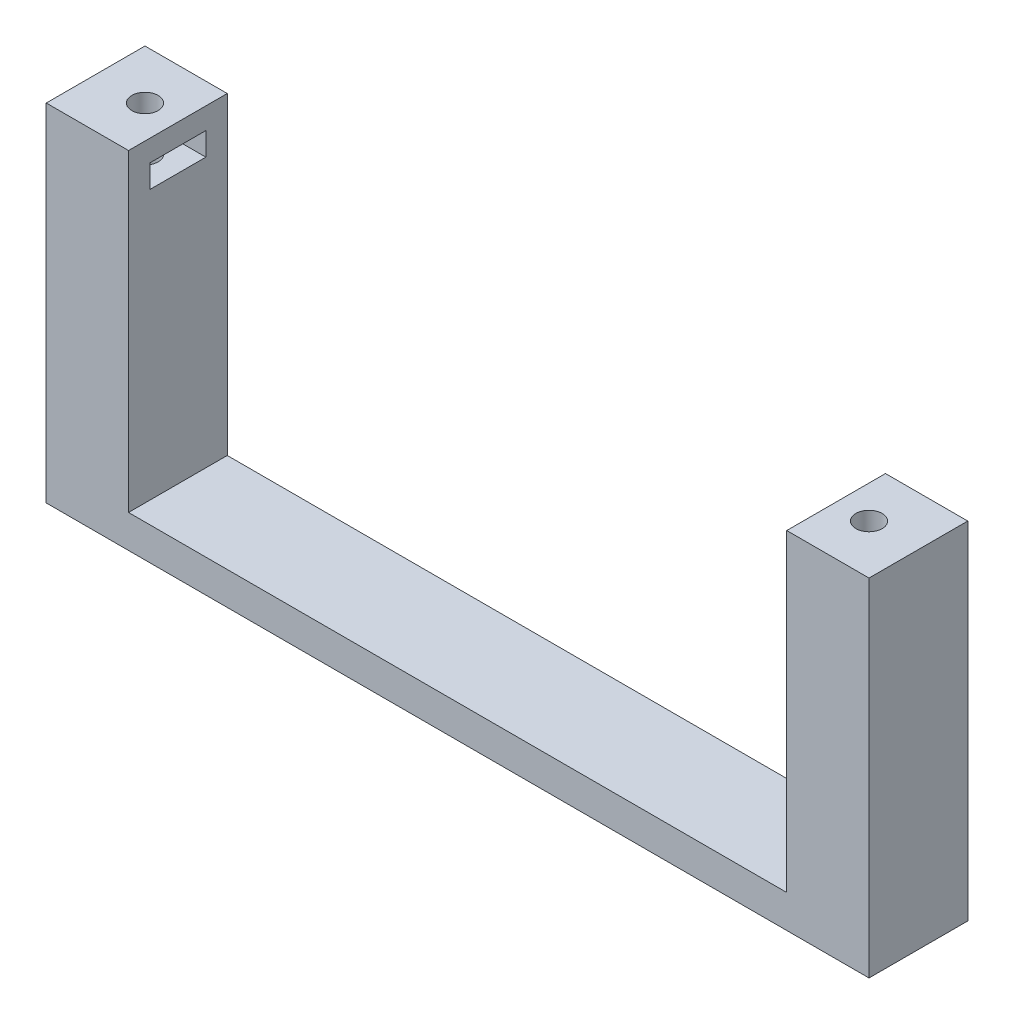
from build123d import *

# Parameters (mm, degrees)
SKETCH2_W         = 100
SKETCH2_H         = 12
SKETCH2_R         = 1.6
BODY_DEPTH        = 4
SKETCH4_W         = 10
SKETCH4_H         = 12
SKETCH4_R         = 1.6
WINGS_DEPTH       = 38.1
SKETCH6_W         = 6.8
SKETCH6_H         = 2.8
CAPTIVE_NUT_DEPTH = 8.5
CIRPATTERN1_COUNT = 2


with BuildPart() as part:
    # Sketch2 → body (new body)
    with BuildSketch(Plane(origin=(0, 0, 0), x_dir=(1, 0, 0), z_dir=(0, 1, 0))):
        Rectangle(SKETCH2_W, SKETCH2_H)
        with Locations(Location((-44, 0, 0), (0, 0, 270))):
            Circle(SKETCH2_R, mode=Mode.SUBTRACT)
        with Locations(Location((44, 0, 0), (0, 0, 270))):
            Circle(SKETCH2_R, mode=Mode.SUBTRACT)
    extrude(amount=BODY_DEPTH)

    # Sketch4 → wings (add)
    # profile 1 of 2: a face of its own
    with BuildSketch(Plane(origin=(0, 4, 0), x_dir=(1, 0, 0), z_dir=(0, 1, 0))):
        with Locations((-45, 0)):
            Rectangle(SKETCH4_W, SKETCH4_H)
        with Locations(Location((-44, 0, 0), (0, 0, 270))):
            Circle(SKETCH4_R, mode=Mode.SUBTRACT)
    # profile 2 of 2: a face of its own
    with BuildSketch(Plane(origin=(0, 4, 0), x_dir=(1, 0, 0), z_dir=(0, 1, 0))):
        with Locations((45, 0)):
            Rectangle(SKETCH4_W, SKETCH4_H)
        with Locations(Location((44, 0, 0), (0, 0, 270))):
            Circle(SKETCH4_R, mode=Mode.SUBTRACT)
    extrude(amount=WINGS_DEPTH)

    # Sketch6 → captive-nut (cut)
    with BuildSketch(Plane.ZY.offset(-40)):
        with Locations((0, 38.1)):
            Rectangle(SKETCH6_W, SKETCH6_H)
    captive_nut = extrude(amount=-CAPTIVE_NUT_DEPTH, mode=Mode.SUBTRACT)

    # CirPattern1: captive-nut ×2 about axis
    cirpattern1_axis = Axis((0, 0, 0), (0, 1, 0))
    for i in range(1, CIRPATTERN1_COUNT):
        add(captive_nut.rotate(cirpattern1_axis, i * 360 / CIRPATTERN1_COUNT), mode=Mode.SUBTRACT)


solid = part.part
